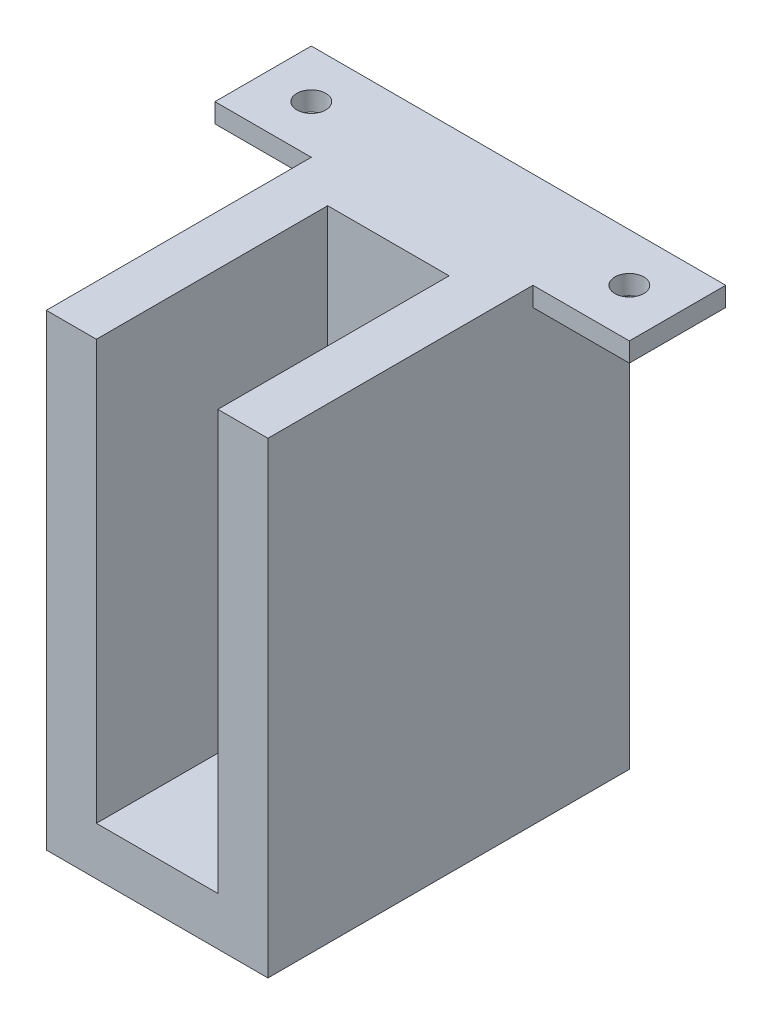
from build123d import *

# Parameters (mm, degrees)
SKETCH1_W           = 23
SKETCH1_H           = 37.5
BOSS_EXTRUDE1_DEPTH = 48.5
SKETCH2_W           = 12.6
SKETCH2_H           = 24
CUT_EXTRUDE1_DEPTH  = 43.5
SKETCH3_W           = 12.6
SKETCH3_H           = 3
CUT_EXTRUDE2_DEPTH  = 5
SKETCH4_W           = 10
SKETCH4_H           = 2
BOSS_EXTRUDE2_DEPTH = 10
SKETCH5_W           = 10
SKETCH5_H           = 2
BOSS_EXTRUDE3_DEPTH = 10
SKETCH6_R           = 1.5
CUT_EXTRUDE3_DEPTH  = 10


with BuildPart() as part:
    # Sketch1 → Boss-Extrude1 (new body)
    with BuildSketch(Plane(origin=(0, 0, 0), x_dir=(1, 0, 0), z_dir=(0, 1, 0))):
        Rectangle(SKETCH1_W, SKETCH1_H)
    extrude(amount=BOSS_EXTRUDE1_DEPTH)

    # Sketch2 → Cut-Extrude1 (cut)
    with BuildSketch(Plane(origin=(0, 48.5, 0), x_dir=(1, 0, 0), z_dir=(0, 1, 0))):
        with Locations((0, -6.75)):
            Rectangle(SKETCH2_W, SKETCH2_H)
    extrude(amount=-CUT_EXTRUDE1_DEPTH, mode=Mode.SUBTRACT)

    # Sketch3 → Cut-Extrude2 (cut)
    with BuildSketch(Plane.XY.offset(-5.25)):
        with Locations((0, 26.5)):
            Rectangle(SKETCH3_W, SKETCH3_H)
    extrude(amount=-CUT_EXTRUDE2_DEPTH, mode=Mode.SUBTRACT)

    # Sketch4 → Boss-Extrude2 (add)
    with BuildSketch(Plane.ZY.offset(11.5)):
        with Locations((-13.75, 47.5)):
            Rectangle(SKETCH4_W, SKETCH4_H)
    extrude(amount=BOSS_EXTRUDE2_DEPTH)

    # Sketch5 → Boss-Extrude3 (add)
    with BuildSketch(Plane(origin=(11.5, 0, 0), x_dir=(0, 0, -1), z_dir=(1, 0, 0))):
        with Locations((13.75, 47.5)):
            Rectangle(SKETCH5_W, SKETCH5_H)
    extrude(amount=BOSS_EXTRUDE3_DEPTH)

    # Sketch6 → Cut-Extrude3 (cut)
    with BuildSketch(Plane(origin=(0, 48.5, 0), x_dir=(1, 0, 0), z_dir=(0, 1, 0))):
        with Locations(Location((16.5, 13.75, 0), (0, 0, 270))):
            Circle(SKETCH6_R)
        with Locations(Location((-16.5, 13.75, 0), (0, 0, 270))):
            Circle(SKETCH6_R)
    extrude(amount=-CUT_EXTRUDE3_DEPTH, mode=Mode.SUBTRACT)


solid = part.part
